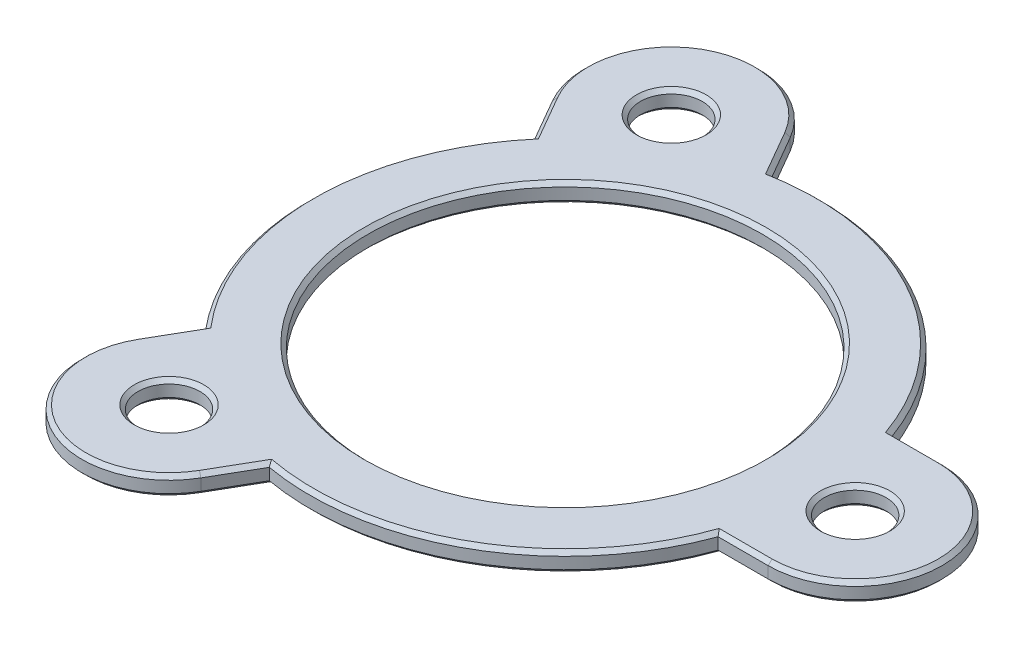
from build123d import *

# Parameters (mm, degrees)
SKETCH_1_R      = 1.6
SKETCH_1_R_2    = 10.2
EXTRUDE_1_DEPTH = 1
CHAMFER_1_SIZE  = 0.2


with BuildPart() as part:
    # 草图1 → 凸台-拉伸1 (new body)
    with BuildSketch(Plane(origin=(0, 0, 0), x_dir=(1, 0, 0), z_dir=(0, 1, 0))):
        with BuildLine():
            ThreePointArc((-2.307521047, -12.996743693), (6.6, -11.43153533), (12.409270728, -4.5))
            Line((12.409270728, -4.5), (15, -4.5))
            ThreePointArc((15, -4.5), (19.5, 0), (15, 4.5))
            Line((15, 4.5), (12.409270728, 4.5))
            ThreePointArc((12.409270728, 4.5), (6.6, 11.43153533), (-2.307521047, 12.996743693))
            Line((-2.307521047, 12.996743693), (-3.602885683, 15.240381057))
            ThreePointArc((-3.602885683, 15.240381057), (-9.75, 16.887495374), (-11.397114317, 10.740381057))
            Line((-11.397114317, 10.740381057), (-10.101749681, 8.496743693))
            ThreePointArc((-10.101749681, 8.496743693), (-13.2, 0), (-10.101749681, -8.496743693))
            Line((-10.101749681, -8.496743693), (-11.397114317, -10.740381057))
            ThreePointArc((-11.397114317, -10.740381057), (-9.75, -16.887495374), (-3.602885683, -15.240381057))
            Line((-3.602885683, -15.240381057), (-2.307521047, -12.996743693))
        make_face()
        with Locations(Location((-7.5, -12.990381057, 0), (0, 0, 270))):
            Circle(SKETCH_1_R, mode=Mode.SUBTRACT)
        with Locations(Location((15, 0, 0), (0, 0, 270))):
            Circle(SKETCH_1_R, mode=Mode.SUBTRACT)
        with Locations(Location((0, 0, 0), (0, 0, 270))):
            Circle(SKETCH_1_R_2, mode=Mode.SUBTRACT)
        with Locations(Location((-7.5, 12.990381057, 0), (0, 0, 270))):
            Circle(SKETCH_1_R, mode=Mode.SUBTRACT)
    extrude(amount=EXTRUDE_1_DEPTH)

    # 倒角1
    chamfer_1_edges = [part.edges().sort_by_distance(p)[0] for p in [
        (19.5, 1, 0),
        (13.704635364, 1, -4.5),
        (15, 0, -1.6),
        (-7.5, 0, 11.390381057),
        (-7.5, 0, -14.590381057),
        (0, 0, -10.2),
        (6.6, 0, 11.43153533),
        (-2.955203365, 0, 14.118562375),
        (-9.75, 0, 16.887495374),
        (6.6, 1, -11.43153533),
        (-10.749431999, 0, 9.618562375),
        (-13.2, 0, 0),
        (-10.749431999, 0, -9.618562375),
        (-9.75, 0, -16.887495374),
        (-2.955203365, 0, -14.118562375),
        (6.6, 0, -11.43153533),
        (13.704635364, 0, -4.5),
        (19.5, 0, 0),
        (-2.955203365, 1, -14.118562375),
        (13.704635364, 0, 4.5),
        (-9.75, 1, -16.887495374),
        (-10.749431999, 1, -9.618562375),
        (-13.2, 1, 0),
        (-10.749431999, 1, 9.618562375),
        (-9.75, 1, 16.887495374),
        (-2.955203365, 1, 14.118562375),
        (6.6, 1, 11.43153533),
        (0, 1, -10.2),
        (-7.5, 1, -14.590381057),
        (-7.5, 1, 11.390381057),
        (15, 1, -1.6),
        (13.704635364, 1, 4.5),
    ]]
    chamfer(chamfer_1_edges, length=CHAMFER_1_SIZE)


solid = part.part
